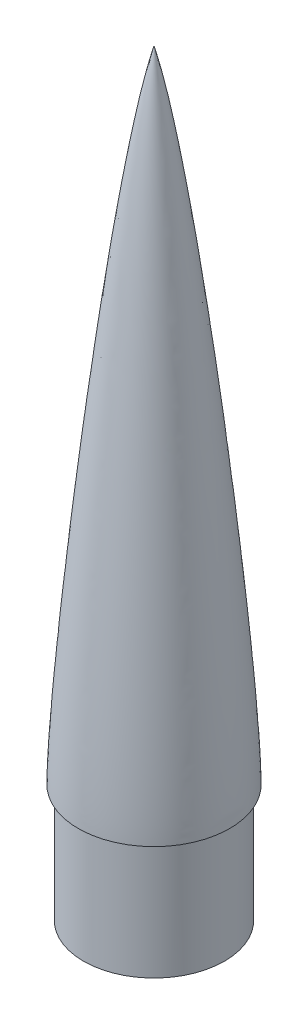
from build123d import *


with BuildPart() as part:
    # Sketch2 → Revolve1 (revolve)
    with BuildSketch(Plane.XY, mode=Mode.PRIVATE) as revolve1_sk:
        with BuildLine():
            Line((0, 0), (-5.5, 0))
            Line((-5.5, 0), (-5.5, 7))
            Line((-5.5, 7), (-27, 12))
            Line((-27, 12), (-27, 57))
            Line((-27, 57), (-29, 57))
            add(Edge.make_bspline(
                [(-29, 57), (-28.821778515, 95.959298407), (-11.952510438, 259.848987743), (0, 302)],
                knots=[0, 0, 0, 0, 0.899176788, 0.899176788, 0.899176788, 0.899176788], degree=3))
            Line((0, 302), (0, 0))
        make_face()
    revolve(revolve1_sk.sketch.rotate(Axis((0, 0, 0), (0, 1, 0)), 270), axis=Axis((0, 0, 0), (0, 1, 0)))


solid = part.part
